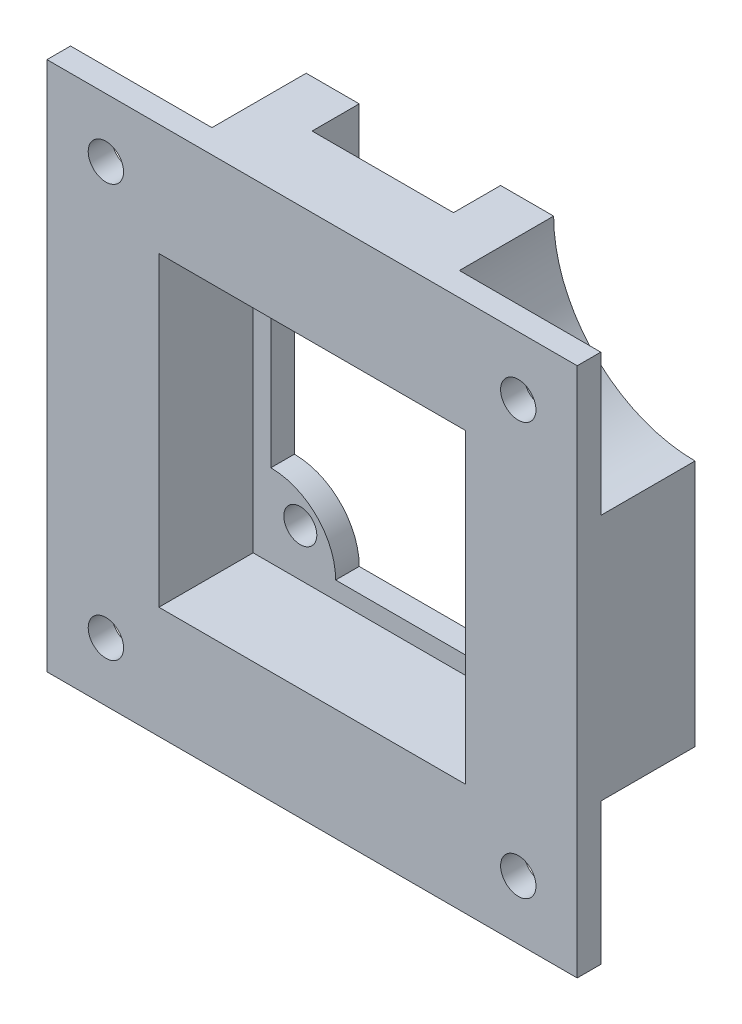
from build123d import *

# Parameters (mm, degrees)
CROQUIS1_W              = 45
CROQUIS1_H              = 45
SALIENTE_EXTRUIR1_DEPTH = 10
CORTAR_EXTRUIR1_DEPTH   = 10
CROQUIS3_W              = 26
CROQUIS3_H              = 26
CORTAR_EXTRUIR5_DEPTH   = 8
CROQUIS4_W              = 12
CROQUIS4_H              = 11
CORTAR_EXTRUIR6_DEPTH   = 4
CORTAR_EXTRUIR7_DEPTH   = 4
CROQUIS6_R              = 1.5
CORTAR_EXTRUIR8_DEPTH   = 24
CROQUIS7_R              = 1.5
CORTAR_EXTRUIR9_DEPTH   = 8


with BuildPart() as part:
    # Croquis1 → Saliente-Extruir1 (new body)
    with BuildSketch(Plane.XY):
        Rectangle(CROQUIS1_W, CROQUIS1_H)
    extrude(amount=SALIENTE_EXTRUIR1_DEPTH)

    # Croquis2 → Cortar-Extruir1 (cut)
    with BuildSketch(Plane.XY.offset(10)):
        with BuildLine():
            ThreePointArc((-11.5, -6), (-7.610912703, -7.610912703), (-6, -11.5))
            Line((-6, -11.5), (6, -11.5))
            ThreePointArc((6, -11.5), (7.610912703, -7.610912703), (11.5, -6))
            Line((11.5, -6), (11.5, 6))
            ThreePointArc((11.5, 6), (7.610912703, 7.610912703), (6, 11.5))
            Line((6, 11.5), (-6, 11.5))
            ThreePointArc((-6, 11.5), (-7.610912703, 7.610912703), (-11.5, 6))
            Line((-11.5, 6), (-11.5, -6))
        make_face()
    extrude(amount=-CORTAR_EXTRUIR1_DEPTH, mode=Mode.SUBTRACT)

    # Croquis3 → Cortar-Extruir5 (cut)
    with BuildSketch(Plane.XY.offset(10)):
        Rectangle(CROQUIS3_W, CROQUIS3_H)
    extrude(amount=-CORTAR_EXTRUIR5_DEPTH, mode=Mode.SUBTRACT)

    # Croquis4 → Cortar-Extruir6 (cut)
    with BuildSketch(Plane(origin=(0, 0, 0), x_dir=(-1, 0, 0), z_dir=(0, 0, -1))):
        with Locations((0, 17)):
            Rectangle(CROQUIS4_W, CROQUIS4_H)
    extrude(amount=-CORTAR_EXTRUIR6_DEPTH, mode=Mode.SUBTRACT)

    # Croquis5 → Cortar-Extruir7 (cut)
    with BuildSketch(Plane(origin=(0, 0, 0), x_dir=(-1, 0, 0), z_dir=(0, 0, -1))):
        with BuildLine():
            ThreePointArc((-7.6, 9), (-9.989949494, 9.989949494), (-9, 7.6))
            Line((-9, 7.6), (-9, 9))
            Line((-9, 9), (-7.6, 9))
        make_face()
        with BuildLine():
            Line((-9, 9), (-9, 7.6))
            ThreePointArc((-9, 7.6), (-8.010050506, 8.010050506), (-7.6, 9))
            Line((-7.6, 9), (-9, 9))
        make_face()
        with BuildLine():
            ThreePointArc((7.6, 9), (8.010050506, 8.010050506), (9, 7.6))
            Line((9, 7.6), (9, 9))
            Line((9, 9), (7.6, 9))
        make_face()
        with BuildLine():
            Line((9, 9), (9, 7.6))
            ThreePointArc((9, 7.6), (9.989949494, 8.010050506), (10.4, 9))
            ThreePointArc((10.4, 9), (9, 10.4), (7.6, 9))
            Line((7.6, 9), (9, 9))
        make_face()
        with BuildLine():
            ThreePointArc((9, -7.6), (8.010050506, -8.010050506), (7.6, -9))
            Line((7.6, -9), (9, -9))
            Line((9, -9), (9, -7.6))
        make_face()
        with BuildLine():
            Line((9, -9), (7.6, -9))
            ThreePointArc((7.6, -9), (9, -10.4), (10.4, -9))
            ThreePointArc((10.4, -9), (9.989949494, -8.010050506), (9, -7.6))
            Line((9, -7.6), (9, -9))
        make_face()
        with BuildLine():
            Line((-9, -7.6), (-9, -9))
            Line((-9, -9), (-7.6, -9))
            ThreePointArc((-7.6, -9), (-8.010050506, -8.010050506), (-9, -7.6))
        make_face()
        with BuildLine():
            Line((-7.6, -9), (-9, -9))
            Line((-9, -9), (-9, -7.6))
            ThreePointArc((-9, -7.6), (-9.989949494, -9.989949494), (-7.6, -9))
        make_face()
    extrude(amount=-CORTAR_EXTRUIR7_DEPTH, mode=Mode.SUBTRACT)

    # Croquis6 → Cortar-Extruir8 (cut)
    with BuildSketch(Plane(origin=(0, 0, 0), x_dir=(-1, 0, 0), z_dir=(0, 0, -1))):
        with Locations((-17.5, 17.5)):
            Circle(CROQUIS6_R)
        with Locations((-17.5, -17.5)):
            Circle(CROQUIS6_R)
        with Locations((17.5, -17.5)):
            Circle(CROQUIS6_R)
        with Locations((17.5, 17.5)):
            Circle(CROQUIS6_R)
    extrude(amount=-CORTAR_EXTRUIR8_DEPTH, mode=Mode.SUBTRACT)

    # Croquis7 → Cortar-Extruir9 (cut)
    # profile 1 of 4: a face of its own
    with BuildSketch(Plane(origin=(0, 0, 0), x_dir=(-1, 0, 0), z_dir=(0, 0, -1))):
        with BuildLine():
            Line((-22.5, 22.5), (-22.5, 10.5))
            ThreePointArc((-22.5, 10.5), (-14.014718626, 14.014718626), (-10.5, 22.5))
            Line((-10.5, 22.5), (-22.5, 22.5))
        make_face()
        with Locations((-17.5, 17.5)):
            Circle(CROQUIS7_R, mode=Mode.SUBTRACT)
    # profile 2 of 4: a face of its own
    with BuildSketch(Plane(origin=(0, 0, 0), x_dir=(-1, 0, 0), z_dir=(0, 0, -1))):
        with BuildLine():
            ThreePointArc((10.5, 22.5), (14.014718626, 14.014718626), (22.5, 10.5))
            Line((22.5, 10.5), (22.5, 22.5))
            Line((22.5, 22.5), (10.5, 22.5))
        make_face()
        with Locations((17.5, 17.5)):
            Circle(CROQUIS7_R, mode=Mode.SUBTRACT)
    # profile 3 of 4: a face of its own
    with BuildSketch(Plane(origin=(0, 0, 0), x_dir=(-1, 0, 0), z_dir=(0, 0, -1))):
        with BuildLine():
            Line((10.5, -22.5), (22.5, -22.5))
            Line((22.5, -22.5), (22.5, -10.5))
            ThreePointArc((22.5, -10.5), (14.014718626, -14.014718626), (10.5, -22.5))
        make_face()
        with Locations((17.5, -17.5)):
            Circle(CROQUIS7_R, mode=Mode.SUBTRACT)
    # profile 4 of 4: a face of its own
    with BuildSketch(Plane(origin=(0, 0, 0), x_dir=(-1, 0, 0), z_dir=(0, 0, -1))):
        with BuildLine():
            Line((-22.5, -22.5), (-10.5, -22.5))
            ThreePointArc((-10.5, -22.5), (-14.014718626, -14.014718626), (-22.5, -10.5))
            Line((-22.5, -10.5), (-22.5, -22.5))
        make_face()
        with Locations((-17.5, -17.5)):
            Circle(CROQUIS7_R, mode=Mode.SUBTRACT)
    extrude(amount=-CORTAR_EXTRUIR9_DEPTH, mode=Mode.SUBTRACT)


solid = part.part
